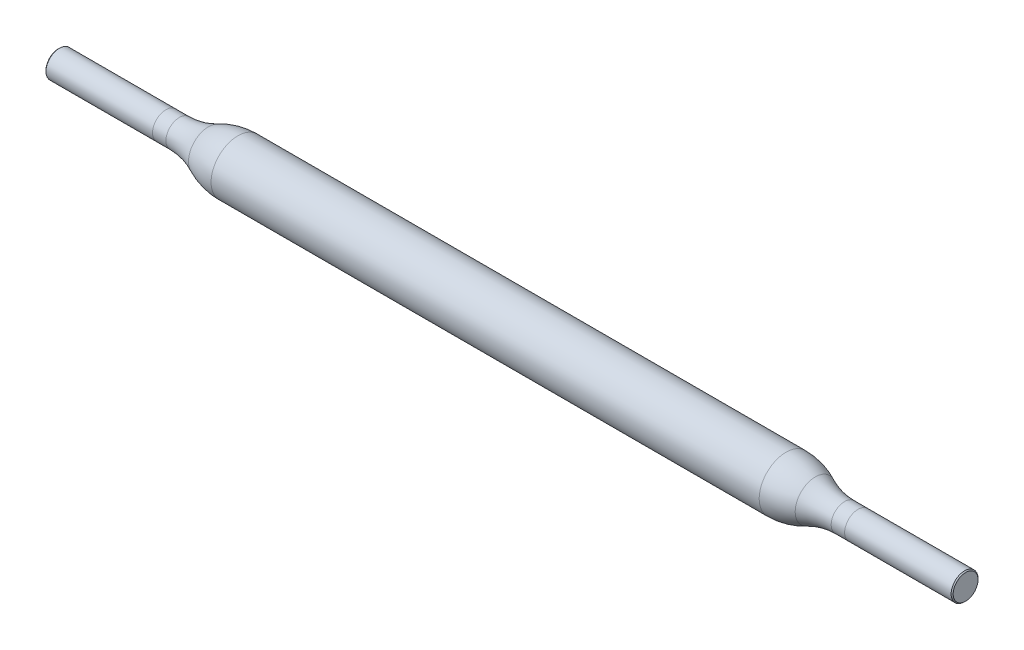
from build123d import *

# Parameters (mm, degrees)
CHAMFER1_SIZE = 0.075


with BuildPart() as part:
    # Sketch1 → Revolve1 (revolve)
    with BuildSketch(Plane.XY, mode=Mode.PRIVATE) as revolve1_sk:
        with BuildLine():
            Line((-33.75, 0), (33.75, 0))
            Line((33.75, 0), (33.75, 1))
            Line((33.75, 1), (24.75, 1))
            ThreePointArc((24.75, 1), (23.631966011, 1.126602828), (22.570550528, 1.5))
            ThreePointArc((22.570550528, 1.5), (21.509135045, 1.873397172), (20.391101056, 2))
            Line((20.391101056, 2), (-20.391101056, 2))
            ThreePointArc((-20.391101056, 2), (-21.509135045, 1.873397172), (-22.570550528, 1.5))
            ThreePointArc((-22.570550528, 1.5), (-23.631966011, 1.126602828), (-24.75, 1))
            Line((-24.75, 1), (-33.75, 1))
            Line((-33.75, 1), (-33.75, 0))
        make_face()
    revolve(revolve1_sk.sketch.rotate(Axis((-33.75, 0, 0), (1, 0, 0)), 90), axis=Axis((-33.75, 0, 0), (1, 0, 0)))

    # Chamfer1
    chamfer1_edges = [part.edges().sort_by_distance(p)[0] for p in [
        (33.75, 0, -1),
        (-33.75, 0, -1),
    ]]
    chamfer(chamfer1_edges, length=CHAMFER1_SIZE)


solid = part.part
